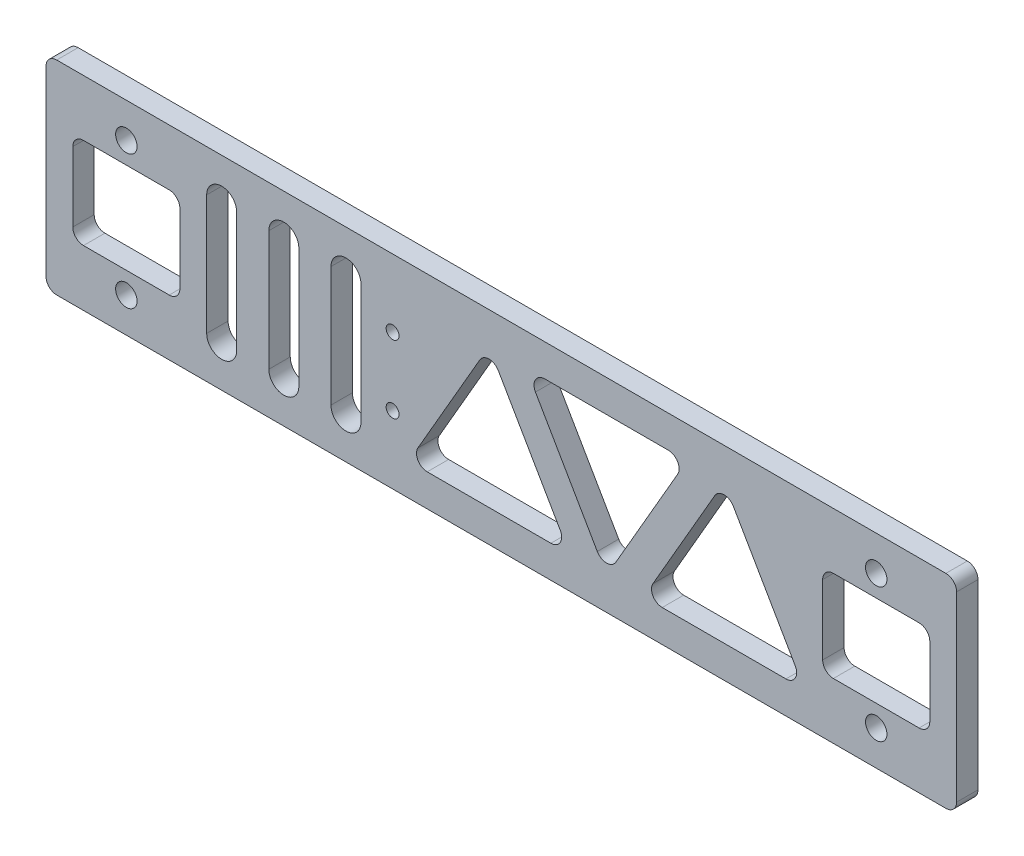
from build123d import *

# Parameters (mm, degrees)
SKETCH_1_W          = 170
SKETCH_1_H          = 38
EXTRUDE_1_DEPTH     = 4
SKETCH_2_R          = 2
CUT_EXTRUDE_1_DEPTH = 4
SKETCH_3_R          = 1.2
CUT_EXTRUDE_2_DEPTH = 10
SKETCH_4_W          = 20
SKETCH_4_H          = 17
CUT_EXTRUDE_3_DEPTH = 10
FILLET_1_R          = 2
FILLET_2_R          = 2
CUT_EXTRUDE_4_DEPTH = 10
FILLET_3_R          = 2
CUT_EXTRUDE_5_DEPTH = 10


with BuildPart() as part:
    # 草图1 → 凸台-拉伸1 (new body)
    with BuildSketch(Plane.XY):
        Rectangle(SKETCH_1_W, SKETCH_1_H)
    extrude(amount=EXTRUDE_1_DEPTH)

    # 草图2 → 切除-拉伸1 (cut)
    with BuildSketch(Plane.XY.offset(4)):
        with Locations((70, 12.5)):
            Circle(SKETCH_2_R)
        with Locations((70, -12.5)):
            Circle(SKETCH_2_R)
    cut_extrude_1 = extrude(amount=-CUT_EXTRUDE_1_DEPTH, mode=Mode.SUBTRACT)

    # 镜向1: 切除-拉伸1 across plane
    add(cut_extrude_1.mirror(Plane(origin=(0, 0, 0), x_dir=(0, 0, 1), z_dir=(1, 0, 0))), mode=Mode.SUBTRACT)

    # 草图3 → 切除-拉伸2 (cut)
    with BuildSketch(Plane.XY.offset(4)):
        with Locations((-20.295, 6.35)):
            Circle(SKETCH_3_R)
        with Locations((-20.295, -6.35)):
            Circle(SKETCH_3_R)
    extrude(amount=-CUT_EXTRUDE_2_DEPTH, mode=Mode.SUBTRACT)

    # 草图4 → 切除-拉伸3 (cut)
    with BuildSketch(Plane.XY.offset(4)):
        with Locations((-70, 0)):
            Rectangle(SKETCH_4_W, SKETCH_4_H)
    cut_extrude_3 = extrude(amount=-CUT_EXTRUDE_3_DEPTH, mode=Mode.SUBTRACT)

    # 镜向2: 切除-拉伸3 across plane
    add(cut_extrude_3.mirror(Plane(origin=(0, 0, 0), x_dir=(0, 0, 1), z_dir=(1, 0, 0))), mode=Mode.SUBTRACT)

    # 圆角1
    fillet_1_edges = [part.edges().sort_by_distance(p)[0] for p in [
        (-60, 8.5, 2),
        (-60, -8.5, 2),
        (-80, -8.5, 2),
        (-80, 8.5, 2),
        (60, -8.5, 2),
        (60, 8.5, 2),
        (80, 8.5, 2),
        (80, -8.5, 2),
    ]]
    fillet(fillet_1_edges, radius=FILLET_1_R)

    # 圆角2
    fillet_2_edges = [part.edges().sort_by_distance(p)[0] for p in [
        (85, -19, 2),
        (-85, -19, 2),
        (-85, 19, 2),
        (85, 19, 2),
    ]]
    fillet(fillet_2_edges, radius=FILLET_2_R)

    # 草图5 → 切除-拉伸4 (cut)
    with BuildSketch(Plane.XY.offset(4)):
        Polygon((-2.283893001, 13), (-17.295, -13), (12.727213998, -13), align=None)
        Polygon((4.644310229, 13), (19.655417228, -13), (34.666524227, 13), align=None)
        Polygon((41.594727457, 13), (26.583620458, -13), (56.605834456, -13), align=None)
    extrude(amount=-CUT_EXTRUDE_4_DEPTH, mode=Mode.SUBTRACT)

    # 圆角3
    fillet_3_edges = [part.edges().sort_by_distance(p)[0] for p in [
        (4.644310229, 13, 2),
        (34.666524227, 13, 2),
        (19.655417228, -13, 2),
        (41.594727457, 13, 2),
        (56.605834456, -13, 2),
        (26.583620458, -13, 2),
        (-2.283893001, 13, 2),
        (12.727213998, -13, 2),
        (-17.295, -13, 2),
    ]]
    fillet(fillet_3_edges, radius=FILLET_3_R)

    # 草图6 → 切除-拉伸5 (cut)
    with BuildSketch(Plane.XY.offset(4)):
        with BuildLine():
            Line((-55, -11.2), (-55, 11.2))
            ThreePointArc((-55, 11.2), (-52.2, 14), (-49.4, 11.2))
            Line((-49.4, 11.2), (-49.4, -11.2))
            ThreePointArc((-49.4, -11.2), (-52.2, -14), (-55, -11.2))
        make_face()
        with BuildLine():
            Line((-43.4, -11.2), (-43.4, 11.2))
            ThreePointArc((-43.4, 11.2), (-40.6, 14), (-37.8, 11.2))
            Line((-37.8, 11.2), (-37.8, -11.2))
            ThreePointArc((-37.8, -11.2), (-40.6, -14), (-43.4, -11.2))
        make_face()
        with BuildLine():
            Line((-31.8, -11.2), (-31.8, 11.2))
            ThreePointArc((-31.8, 11.2), (-29, 14), (-26.2, 11.2))
            Line((-26.2, 11.2), (-26.2, -11.2))
            ThreePointArc((-26.2, -11.2), (-29, -14), (-31.8, -11.2))
        make_face()
    extrude(amount=-CUT_EXTRUDE_5_DEPTH, mode=Mode.SUBTRACT)


solid = part.part
